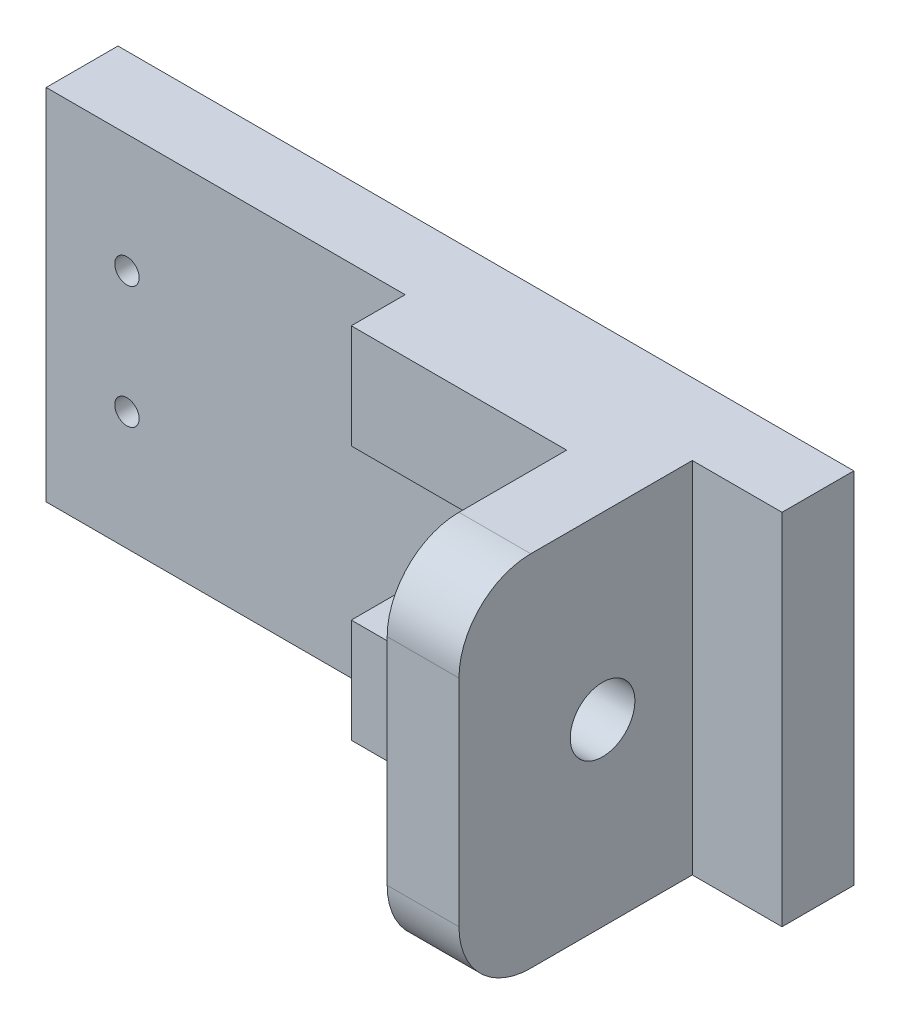
from build123d import *

# Parameters (mm, degrees)
SCHIZZO1_W                   = 205
SCHIZZO1_H                   = 100
ESTRUSIONE_ESTRUSIONE1_DEPTH = 20
SCHIZZO2_W                   = 20
SCHIZZO2_H                   = 100
ESTRUSIONE_ESTRUSIONE2_DEPTH = 65
TAGLIO_ESTRUSIONE1_DEPTH     = 20
SCHIZZO4_R                   = 9
TAGLIO_ESTRUSIONE2_DEPTH     = 20
SCHIZZO5_W                   = 60
SCHIZZO5_H                   = 29
ESTRUSIONE_ESTRUSIONE3_DEPTH = 15
FORO_FILETTATO_M8_1_D        = 6.8


with BuildPart() as part:
    # Schizzo1 → Estrusione-Estrusione1 (new body)
    with BuildSketch(Plane.XY):
        Rectangle(SCHIZZO1_W, SCHIZZO1_H)
    extrude(amount=ESTRUSIONE_ESTRUSIONE1_DEPTH)

    # Schizzo2 → Estrusione-Estrusione2 (add)
    with BuildSketch(Plane.XY.offset(20)):
        with Locations((67.5, 0)):
            Rectangle(SCHIZZO2_W, SCHIZZO2_H)
    extrude(amount=ESTRUSIONE_ESTRUSIONE2_DEPTH)

    # Schizzo3 → Taglio-Estrusione1 (cut)
    with BuildSketch(Plane.ZY.offset(-57.5)):
        with BuildLine():
            Line((65, 50), (85, 50))
            Line((85, 50), (85, 30))
            ThreePointArc((85, 30), (79.142135624, 44.142135624), (65, 50))
        make_face()
        with BuildLine():
            Line((85, -30), (85, -50))
            Line((85, -50), (65, -50))
            ThreePointArc((65, -50), (79.142135624, -44.142135624), (85, -30))
        make_face()
    extrude(amount=-TAGLIO_ESTRUSIONE1_DEPTH, mode=Mode.SUBTRACT)

    # Schizzo4 → Taglio-Estrusione2 (cut)
    with BuildSketch(Plane.ZY.offset(-57.5)):
        with Locations((45, 0)):
            Circle(SCHIZZO4_R)
    extrude(amount=-TAGLIO_ESTRUSIONE2_DEPTH, mode=Mode.SUBTRACT)

    # Schizzo5 → Estrusione-Estrusione3 (add)
    with BuildSketch(Plane.XY.offset(20)):
        with Locations((27.5, -35.5)):
            Rectangle(SCHIZZO5_W, SCHIZZO5_H)
        with Locations((27.5, 35.5)):
            Rectangle(SCHIZZO5_W, SCHIZZO5_H)
    extrude(amount=ESTRUSIONE_ESTRUSIONE3_DEPTH)

    # Foro filettato M8-1 (through all)
    with Locations(Plane(origin=(-80, 17, 20), x_dir=(1, 0, 0), z_dir=(0, 0, 1))):
        with Locations((0, 0), (0, -34)):
            Hole(FORO_FILETTATO_M8_1_D / 2)


solid = part.part
